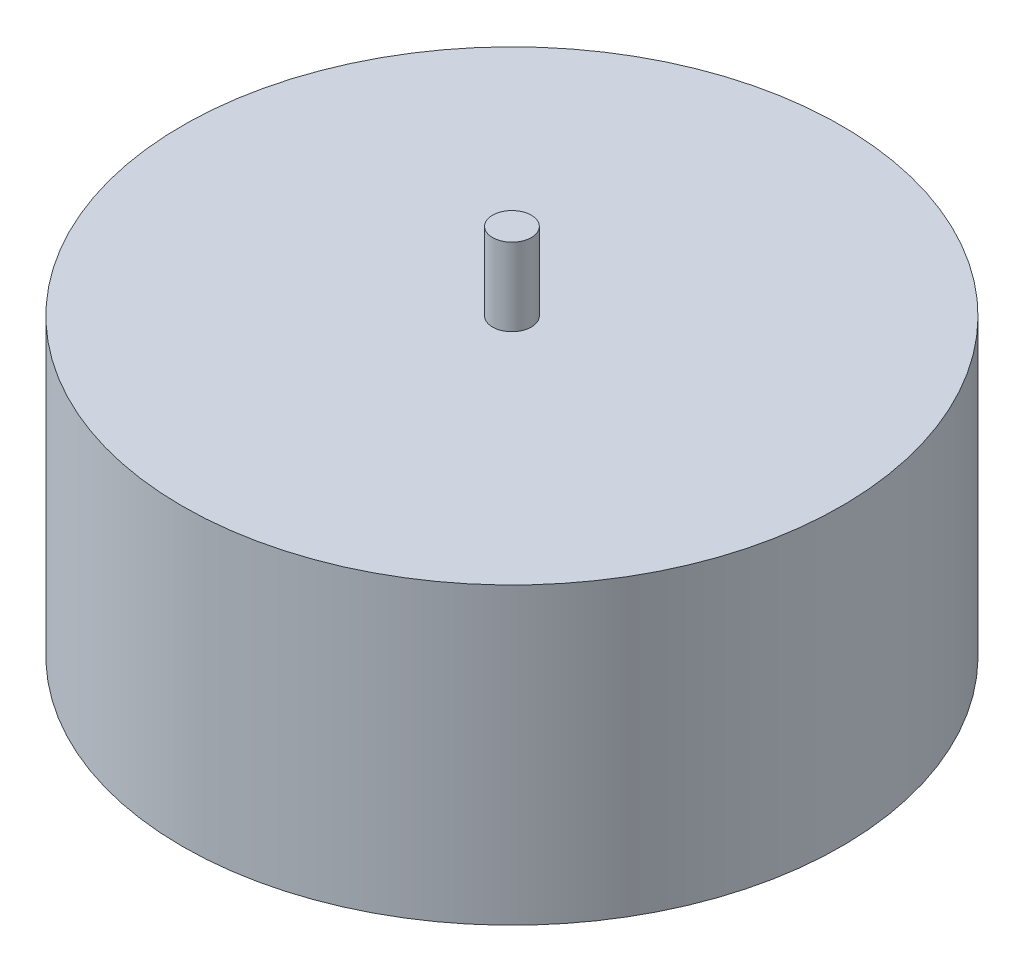
from build123d import *

# Parameters (mm, degrees)
SKETCH1_R           = 42.5
BOSS_EXTRUDE1_DEPTH = 38
SKETCH2_R           = 2.5
BOSS_EXTRUDE2_DEPTH = 10


with BuildPart() as part:
    # Sketch1 → Boss-Extrude1 (new body)
    with BuildSketch(Plane(origin=(0, 0, 0), x_dir=(1, 0, 0), z_dir=(0, 1, 0))):
        with Locations(Location((0, 0, 0), (0, 0, 270))):
            Circle(SKETCH1_R)
    extrude(amount=BOSS_EXTRUDE1_DEPTH)

    # Sketch2 → Boss-Extrude2 (add)
    with BuildSketch(Plane(origin=(0, 38, 0), x_dir=(1, 0, 0), z_dir=(0, 1, 0))):
        with Locations(Location((0, 0, 0), (0, 0, 270))):
            Circle(SKETCH2_R)
    extrude(amount=BOSS_EXTRUDE2_DEPTH)


solid = part.part
